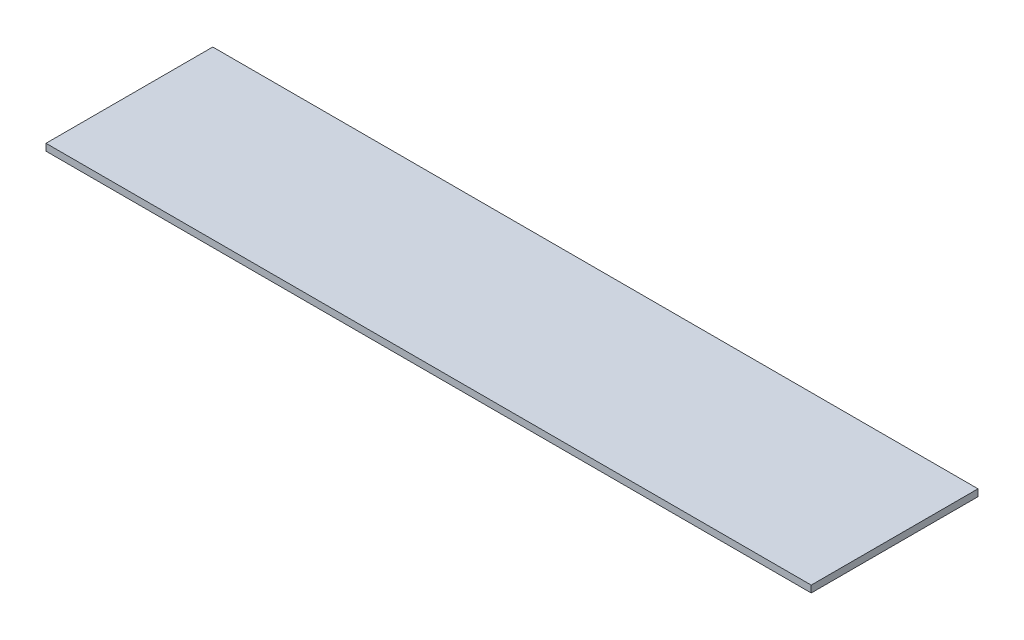
from build123d import *

# Parameters (mm, degrees)
SKETCH1_W           = 780
SKETCH1_H           = 170
BOSS_EXTRUDE1_DEPTH = 7


with BuildPart() as part:
    # Sketch1 → Boss-Extrude1 (new body)
    with BuildSketch(Plane(origin=(0, 0, 0), x_dir=(1, 0, 0), z_dir=(0, 1, 0))):
        with Locations((351.383606557, -75.409836066)):
            Rectangle(SKETCH1_W, SKETCH1_H)
    extrude(amount=BOSS_EXTRUDE1_DEPTH)


solid = part.part
